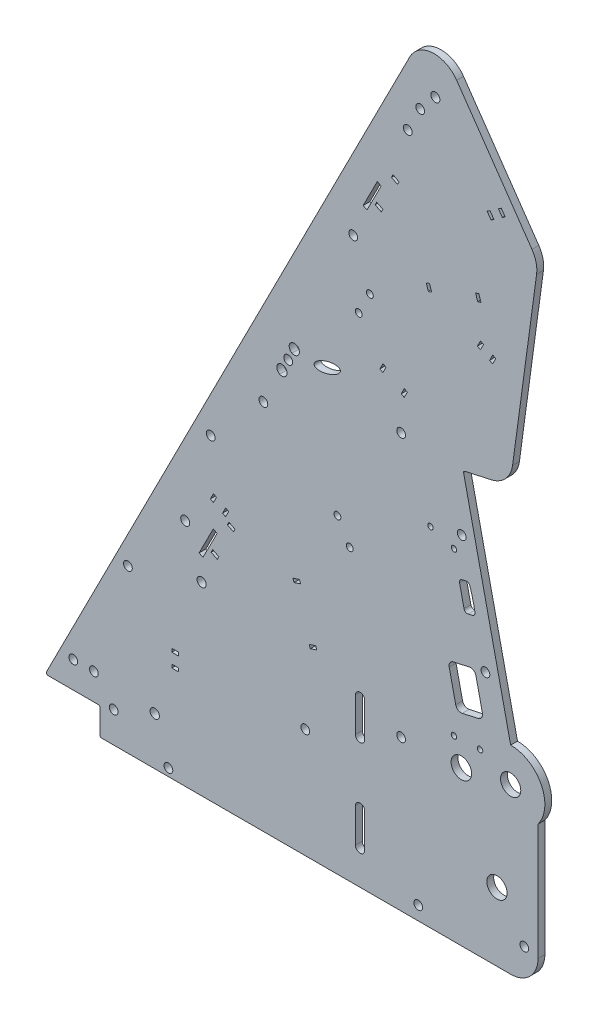
from build123d import *

# Parameters (mm, degrees)
BOSS_EXTRUDE1_DEPTH     = 3.175
SKETCH2_R               = 2.0955
SKETCH2_R_2             = 2.032
SKETCH2_R_3             = 4.699
CUT_EXTRUDE1_DEPTH      = 421.976111717
SKETCH7_R               = 2.159
CUT_EXTRUDE2_DEPTH      = 421.976111717
CUT_EXTRUDE3_REACH      = 422.976
SKETCH10_R              = 2.032
FILLET1_R               = 12.7
FILLET2_R               = 0.79375
SKETCH12_R              = 2.032
CUT_EXTRUDE5_DEPTH      = 411.989226146
CUT_EXTRUDE6_DEPTH      = 411.989226146
CUT_EXTRUDE6_DEPTH_BACK = 411.989226146
SKETCH13_R              = 1.27
SKETCH14_R              = 2.032
SKETCH14_R_2            = 1.6
SKETCH14_RX             = 6.35
SKETCH14_RY             = 2.38125
SKETCH14_W              = 3.175
SKETCH14_H              = 1.5875
CUT_EXTRUDE7_DEPTH      = 411.989226146
SKETCH15_R              = 2.032
CUT_EXTRUDE8_DEPTH      = 411.989226285
FILLET3_R               = 2.54
SKETCH16_R              = 4.7625
CUT_EXTRUDE9_DEPTH      = 411.989226285


with BuildPart() as part:
    # Sketch1 → Boss-Extrude1 (new body)
    with BuildSketch(Plane.XY):
        with BuildLine():
            Line((228.6, -12.7), (228.6, 53.975))
            ThreePointArc((228.6, 53.975), (230.099031657, 70.599515829), (215.9, 79.375))
            Line((215.9, 79.375), (193.909735224, 178.566674323))
            Line((193.909735224, 178.566674323), (215.607913982, 183.377044743))
            Line((215.607913982, 183.377044743), (228.6, 279.4))
            Line((228.6, 279.4), (178.754725958, 351.413083686))
            Line((178.754725958, 351.413083686), (0, 0))
            Line((0, 0), (25.4, 0))
            Line((25.4, 0), (25.4, -12.7))
            Line((25.4, -12.7), (228.6, -12.7))
        make_face()
    extrude(amount=BOSS_EXTRUDE1_DEPTH)

    # Sketch2 → Cut-Extrude1 (cut, through all)
    with BuildSketch(Plane.XY.offset(3.175)):
        with Locations((64.943150167, 94.057839899)):
            Circle(SKETCH2_R)
        with Locations((180.975, 322.164313376)):
            Circle(SKETCH2_R)
        with Locations((72.544547852, 73.173171402)):
            Circle(SKETCH2_R)
        with Locations((193.207821773, 152.394364194)):
            Circle(SKETCH2_R_2)
        with Locations((215.9, 63.5)):
            Circle(SKETCH2_R_3)
        with Locations((173.0375, -6.35)):
            Circle(SKETCH2_R_2)
        with Locations((204.202954161, 102.798527032)):
            Circle(SKETCH2_R_2)
        with Locations((209.55, 19.05)):
            Circle(SKETCH2_R_3)
        with Locations((165.1, 179.3875)):
            Circle(SKETCH2_R_2)
    extrude(amount=-CUT_EXTRUDE1_DEPTH, mode=Mode.SUBTRACT)

    # Sketch7 → Cut-Extrude2 (cut, through all)
    with BuildSketch(Plane.XY.offset(3.175)):
        with Locations((50.8, 9.525)):
            Circle(SKETCH7_R)
        with BuildLine():
            Line((143.891, 3.175), (143.891, 19.05))
            ThreePointArc((143.891, 19.05), (146.05, 21.209), (148.209, 19.05))
            Line((148.209, 19.05), (148.209, 3.175))
            ThreePointArc((148.209, 3.175), (146.05, 1.016), (143.891, 3.175))
        make_face()
        with BuildLine():
            Line((143.891, 47.625), (143.891, 63.5))
            ThreePointArc((143.891, 63.5), (146.05, 65.659), (148.209, 63.5))
            Line((148.209, 63.5), (148.209, 47.625))
            ThreePointArc((148.209, 47.625), (146.05, 45.466), (143.891, 47.625))
        make_face()
    extrude(amount=-CUT_EXTRUDE2_DEPTH, mode=Mode.SUBTRACT)

    # Sketch10 → Cut-Extrude3 (cut, up to next)
    with BuildSketch(Plane.XY.offset(3.175), mode=Mode.PRIVATE) as cut_extrude3_sk1:
        with Locations((165.1, 57.15)):
            Circle(SKETCH10_R)
    cut_extrude3_tool1 = extrude(cut_extrude3_sk1.sketch, amount=-CUT_EXTRUDE3_REACH, mode=Mode.PRIVATE) & part.part
    # Sketch10 → Cut-Extrude3 (cut, up to next)
    with BuildSketch(Plane.XY.offset(3.175), mode=Mode.PRIVATE) as cut_extrude3_sk2:
        with Locations((120.65, 38.1)):
            Circle(SKETCH10_R)
    cut_extrude3_tool2 = extrude(cut_extrude3_sk2.sketch, amount=-CUT_EXTRUDE3_REACH, mode=Mode.PRIVATE) & part.part
    # Sketch10 → Cut-Extrude3 (cut, up to next)
    with BuildSketch(Plane.XY.offset(3.175), mode=Mode.PRIVATE) as cut_extrude3_sk3:
        with Locations((13.046467246, 12.334704411)):
            Circle(SKETCH10_R)
    cut_extrude3_tool3 = extrude(cut_extrude3_sk3.sketch, amount=-CUT_EXTRUDE3_REACH, mode=Mode.PRIVATE) & part.part
    # Sketch10 → Cut-Extrude3 (cut, up to next)
    with BuildSketch(Plane.XY.offset(3.175), mode=Mode.PRIVATE) as cut_extrude3_sk4:
        with Locations((22.571467246, 12.334704411)):
            Circle(SKETCH10_R)
    cut_extrude3_tool4 = extrude(cut_extrude3_sk4.sketch, amount=-CUT_EXTRUDE3_REACH, mode=Mode.PRIVATE) & part.part
    # Sketch10 → Cut-Extrude3 (cut, up to next)
    with BuildSketch(Plane.XY.offset(3.175), mode=Mode.PRIVATE) as cut_extrude3_sk5:
        with Locations((38.360434174, 62.564025462)):
            Circle(SKETCH10_R)
    cut_extrude3_tool5 = extrude(cut_extrude3_sk5.sketch, amount=-CUT_EXTRUDE3_REACH, mode=Mode.PRIVATE) & part.part
    add(cut_extrude3_tool1.solids().sort_by_distance((165.1, 57.15, 3.175))[0], mode=Mode.SUBTRACT)
    add(cut_extrude3_tool2.solids().sort_by_distance((120.65, 38.1, 3.175))[0], mode=Mode.SUBTRACT)
    add(cut_extrude3_tool3.solids().sort_by_distance((13.046467, 12.334704, 3.175))[0], mode=Mode.SUBTRACT)
    add(cut_extrude3_tool4.solids().sort_by_distance((22.571467, 12.334704, 3.175))[0], mode=Mode.SUBTRACT)
    add(cut_extrude3_tool5.solids().sort_by_distance((38.360434, 62.564025, 3.175))[0], mode=Mode.SUBTRACT)

    # Fillet1
    fillet1_edges = [part.edges().sort_by_distance(p)[0] for p in [
        (178.754725958, 351.413083686, 1.5875),
        (228.6, 279.4, 1.5875),
        (215.607913982, 183.377044743, 1.5875),
        (228.6, -12.7, 1.5875),
    ]]
    fillet(fillet1_edges, radius=FILLET1_R)

    # Fillet2
    fillet2_edges = [part.edges().sort_by_distance(p)[0] for p in [
        (25.4, -12.7, 1.5875),
        (25.4, 0, 1.5875),
        (0, 0, 1.5875),
        (193.909735224, 178.566674323, 1.5875),
    ]]
    fillet(fillet2_edges, radius=FILLET2_R)

    # Sketch12 → Cut-Extrude5 (cut, through all)
    with BuildSketch(Plane.XY.offset(3.175)):
        with Locations((31.75, 1.5875)):
            Circle(SKETCH12_R)
        with Locations((222.25, 1.5875)):
            Circle(SKETCH12_R)
        with Locations((57.15, -9.2075)):
            Circle(SKETCH12_R)
    extrude(amount=-CUT_EXTRUDE5_DEPTH, mode=Mode.SUBTRACT)

    # Sketch13 → Cut-Extrude6 (cut, two sides: drawn at the far end of the back side and taken through both)
    with BuildSketch(Plane.XY.offset(3.175).offset(-CUT_EXTRUDE6_DEPTH_BACK)):
        with Locations((189.602197334, 69.980636704)):
            Circle(SKETCH13_R)
        with Locations((201.708862449, 70.509225118)):
            Circle(SKETCH13_R)
        with Locations((178.721644858, 148.532438598)):
            Circle(SKETCH13_R)
        with Locations((189.622629605, 145.09537131)):
            Circle(SKETCH13_R)
        Polygon((186.844411154, 98.950230697), (199.243370445, 101.699013794), (203.36654509, 83.100574858), (190.9675858, 80.351791761), align=None)
        with BuildLine():
            Line((195.12807169, 134.933592333), (193.415301921, 134.553880417))
            ThreePointArc((193.415301921, 134.553880417), (192.420015888, 133.856973634), (192.209029897, 132.660412618))
            Line((192.209029897, 132.660412618), (194.270617219, 123.361193151))
            ThreePointArc((194.270617219, 123.361193151), (194.967524002, 122.365907117), (196.164085018, 122.154921126))
            Line((196.164085018, 122.154921126), (198.109091879, 122.586118766))
            ThreePointArc((198.109091879, 122.586118766), (199.082720469, 123.249946547), (199.330550026, 124.401988414))
            ThreePointArc((199.330550026, 124.401988414), (198.332361402, 129.18494451), (196.979617949, 133.879956193))
            ThreePointArc((196.979617949, 133.879956193), (196.256822614, 134.763465498), (195.12807169, 134.933592333))
        make_face()
    extrude(amount=CUT_EXTRUDE6_DEPTH + CUT_EXTRUDE6_DEPTH_BACK, mode=Mode.SUBTRACT)

    # Sketch14 → Cut-Extrude7 (cut, through all)
    with BuildSketch(Plane.XY.offset(3.175)):
        with Locations((142.875, 247.65)):
            Circle(SKETCH14_R)
        with Locations((112.7125, 182.5625)):
            Circle(SKETCH14_R)
        with Locations((101.196445848, 159.923142748)):
            Circle(SKETCH14_R)
        with Locations((150.594024053, 227.898538502)):
            Circle(SKETCH14_R_2)
        with Locations((145.425401324, 217.737567137)):
            Circle(SKETCH14_R_2)
        with Locations((135.545743513, 131.358540309)):
            Circle(SKETCH14_R_2)
        with Locations((141.245743513, 121.485850706)):
            Circle(SKETCH14_R_2)
        with Locations(Location((130.826142263, 188.461522288), (0, 0, -161.961260538))):
            Ellipse(SKETCH14_RX, SKETCH14_RY)
        Polygon((147.482742003, 261.9243054), (154.04689287, 274.828739034), (155.829519425, 273.921963116), (149.265368558, 261.017529483), align=None)
        Polygon((160.590482388, 279.78010172), (161.310235773, 281.195061549), (164.140155429, 279.75555478), (163.420402045, 278.340594951), align=None)
        Polygon((153.789663007, 266.410402556), (156.619582664, 264.970895787), (155.899829279, 263.555935959), (153.069909623, 264.995442728), align=None)
        Polygon((178.26972852, 245.992253978), (179.240391581, 242.969268992), (177.728899089, 242.483937462), (176.758236028, 245.506922447), align=None)
        Polygon((200.609634347, 249.830809719), (199.638971286, 252.853794704), (201.150463779, 253.339126235), (202.12112684, 250.316141249), align=None)
        Polygon((77.953373051, 97.225512031), (79.735999607, 96.318736114), (73.17184874, 83.41430248), (71.389222185, 84.321078398), align=None)
        Polygon((85.216715955, 103.591834546), (84.49696257, 102.176874718), (87.326882227, 100.737367949), (88.046635611, 102.152327777), align=None)
        Polygon((156.643043941, 199.39992488), (158.08255071, 202.229844536), (156.667590882, 202.949597921), (155.228084113, 200.119678264), align=None)
        Polygon((165.132802911, 195.081404573), (166.57230968, 197.911324229), (167.987269508, 197.191570845), (166.547762739, 194.361651188), align=None)
        Polygon((77.696143189, 88.807175554), (76.976389805, 87.392215725), (79.806309461, 85.952708956), (80.526062846, 87.367668785), align=None)
        Polygon((201.915382504, 234.74968075), (200.475875735, 231.919761094), (201.890835563, 231.200007709), (203.330342332, 234.029927366), align=None)
        Polygon((206.135715047, 229.040747556), (207.575221816, 231.870667212), (208.990181645, 231.150913828), (207.550674876, 228.320994171), align=None)
        Polygon((205.013971437, 288.371538288), (206.820969573, 285.760909487), (208.126283974, 286.664408555), (206.319285837, 289.275037356), align=None)
        Polygon((210.235229039, 291.98553456), (212.042227175, 289.374905759), (213.347541575, 290.278404827), (211.540543439, 292.889033628), align=None)
        Polygon((122.453385221, 73.10367975), (122.951215646, 71.596257739), (125.966059667, 72.591918589), (125.468229242, 74.099340599), align=None)
        Polygon((114.917306673, 95.922796693), (115.415137097, 94.415374682), (118.429981119, 95.411035531), (117.932150694, 96.918457542), align=None)
        with Locations((60.325, 38.89375)):
            Rectangle(SKETCH14_W, SKETCH14_H)
        with Locations((60.325, 32.54375)):
            Rectangle(SKETCH14_W, SKETCH14_H)
        Polygon((78.051560814, 111.424204195), (76.612054045, 108.594284538), (78.027013874, 107.874531154), (79.466520643, 110.70445081), align=None)
        Polygon((82.271893358, 105.715271), (83.711400127, 108.545190657), (85.126359956, 107.825437272), (83.686853187, 104.995517616), align=None)
        with BuildLine():
            add(Edge.make_bspline(
                [(108.753856385, 174.780220945), (110.821723963, 173.728350313), (111.90135404, 175.850790056), (112.980984117, 177.973229798), (110.913116539, 179.025100429)],
                knots=[0, 0, 0, 1.570796327, 1.570796327, 3.141592654, 3.141592654, 3.141592654], degree=2, weights=[1, 0.707106781, 1, 0.707106781, 1]))
            add(Edge.make_bspline(
                [(110.913116539, 179.025100429), (110.77268373, 179.096534959), (110.626511301, 179.154391231), (110.322493118, 179.242488117), (110.165373026, 179.272144601), (109.695542578, 179.315227584), (109.373415846, 179.283109915), (108.9218002, 179.145618276), (108.77365547, 179.084104344), (108.495402792, 178.934315945), (108.365007933, 178.846412483), (108.121928357, 178.644218756), (108.0096946, 178.529696631), (107.813416216, 178.283892413), (107.727754596, 178.151249117), (107.58342172, 177.86715543), (107.526957985, 177.720181494), (107.444132542, 177.416788403), (107.417775942, 177.25846019), (107.397765558, 176.943245973), (107.403605499, 176.786285249), (107.446503964, 176.473637327), (107.48413539, 176.317513381), (107.58741463, 176.020451076), (107.653173274, 175.877669132), (107.813265642, 175.6037409), (107.906595752, 175.474826714), (108.217757093, 175.120973916), (108.473611136, 174.922774438), (108.753856385, 174.780220945)],
                knots=[0, 0, 0, 0, 0.0625, 0.0625, 0.125, 0.125, 0.25, 0.25, 0.3125, 0.3125, 0.375, 0.375, 0.4375, 0.4375, 0.5, 0.5, 0.5625, 0.5625, 0.625, 0.625, 0.6875, 0.6875, 0.75, 0.75, 0.8125, 0.8125, 0.875, 0.875, 1, 1, 1, 1], degree=3))
        make_face()
        with BuildLine():
            add(Edge.make_bspline(
                [(114.511883461, 186.099899571), (116.579751039, 185.048028939), (117.659381116, 187.170468682), (118.739011193, 189.292908424), (116.671143615, 190.344779055)],
                knots=[0, 0, 0, 1.570796327, 1.570796327, 3.141592654, 3.141592654, 3.141592654], degree=2, weights=[1, 0.707106781, 1, 0.707106781, 1]))
            add(Edge.make_bspline(
                [(114.511883461, 186.099899571), (114.371072576, 186.171526418), (114.235866303, 186.257351722), (113.987547839, 186.450065421), (113.872855617, 186.557654504), (113.558328181, 186.915480737), (113.397407635, 187.190062471), (113.24126374, 187.640077887), (113.204646123, 187.792957095), (113.161785412, 188.104373095), (113.155794463, 188.264784445), (113.176022459, 188.579744294), (113.201753482, 188.734678369), (113.28477823, 189.039401247), (113.342554455, 189.189068059), (113.556262174, 189.609540487), (113.758638915, 189.862727621), (114.121215939, 190.164706401), (114.254157477, 190.254446578), (114.53236698, 190.404090785), (114.677524715, 190.464472802), (114.97978581, 190.556739169), (115.136913319, 190.588175808), (115.449881014, 190.619878989), (115.607376248, 190.620744977), (115.924438129, 190.591785045), (116.079517328, 190.562319108), (116.3815103, 190.475083726), (116.53003913, 190.416555249), (116.671143615, 190.344779055)],
                knots=[0, 0, 0, 0, 0.0625, 0.0625, 0.125, 0.125, 0.25, 0.25, 0.3125, 0.3125, 0.375, 0.375, 0.4375, 0.4375, 0.5, 0.5, 0.625, 0.625, 0.6875, 0.6875, 0.75, 0.75, 0.8125, 0.8125, 0.875, 0.875, 0.9375, 0.9375, 1, 1, 1, 1], degree=3))
        make_face()
    extrude(amount=-CUT_EXTRUDE7_DEPTH, mode=Mode.SUBTRACT)

    # Sketch15 → Cut-Extrude8 (cut, through all)
    with BuildSketch(Plane.XY.offset(3.175)):
        with Locations((76.786819993, 134.148053636)):
            Circle(SKETCH15_R)
        with Locations((173.947223848, 313.950707072)):
            Circle(SKETCH15_R)
        with Locations((168.189196772, 302.631028446)):
            Circle(SKETCH15_R)
    extrude(amount=-CUT_EXTRUDE8_DEPTH, mode=Mode.SUBTRACT)

    # Fillet3
    fillet3_edges = [part.edges().sort_by_distance(p)[0] for p in [
        (199.243370445, 101.699013794, 1.5875),
        (203.36654509, 83.100574858, 1.5875),
        (190.9675858, 80.351791761, 1.5875),
        (186.844411154, 98.950230697, 1.5875),
    ]]
    fillet(fillet3_edges, radius=FILLET3_R)

    # Sketch16 → Cut-Extrude9 (cut, through all)
    with BuildSketch(Plane.XY.offset(3.175)):
        with Locations((193.04, 58.801)):
            Circle(SKETCH16_R)
    extrude(amount=-CUT_EXTRUDE9_DEPTH, mode=Mode.SUBTRACT)


solid = part.part
